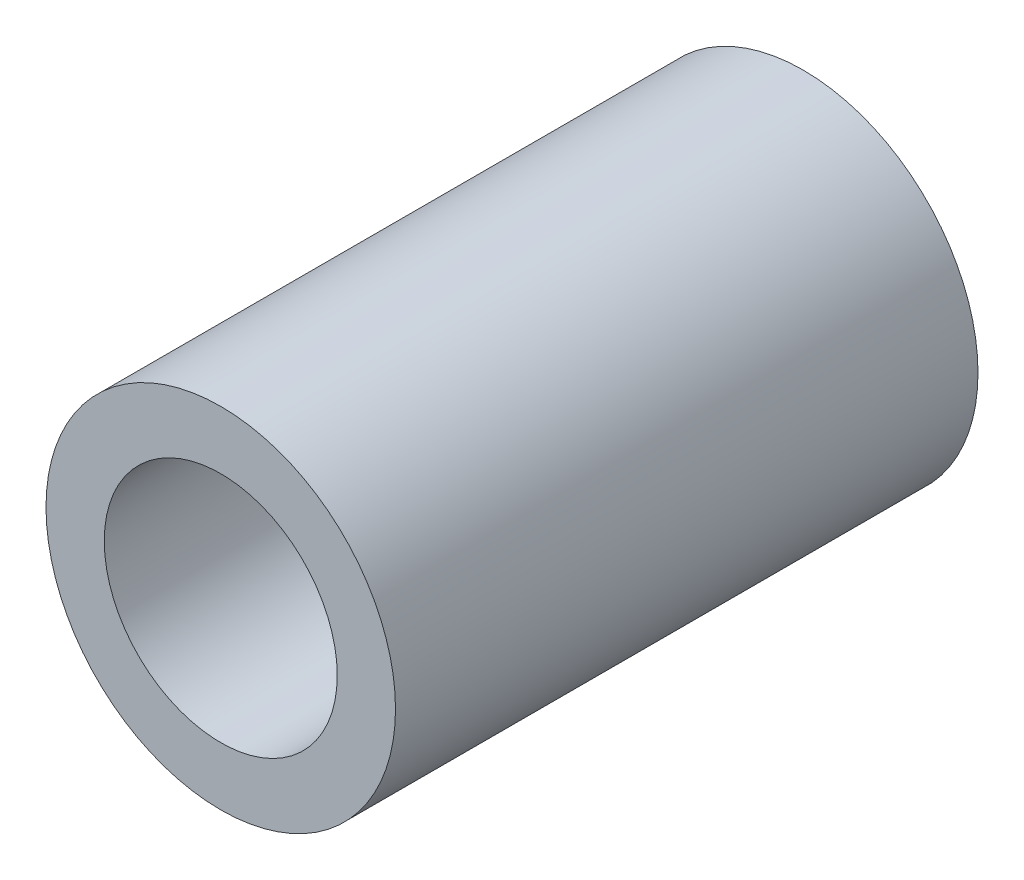
from build123d import *

# Parameters (mm, degrees)
SKETCH1_R           = 30
SKETCH1_R_2         = 20
BOSS_EXTRUDE1_DEPTH = 100


with BuildPart() as part:
    # Sketch1 → Boss-Extrude1 (new body)
    with BuildSketch(Plane.XY):
        with Locations(Location((0, 0, 0), (0, 0, 180))):
            Circle(SKETCH1_R)
        with Locations(Location((0, 0, 0), (0, 0, 180))):
            Circle(SKETCH1_R_2, mode=Mode.SUBTRACT)
    extrude(amount=BOSS_EXTRUDE1_DEPTH)


solid = part.part
